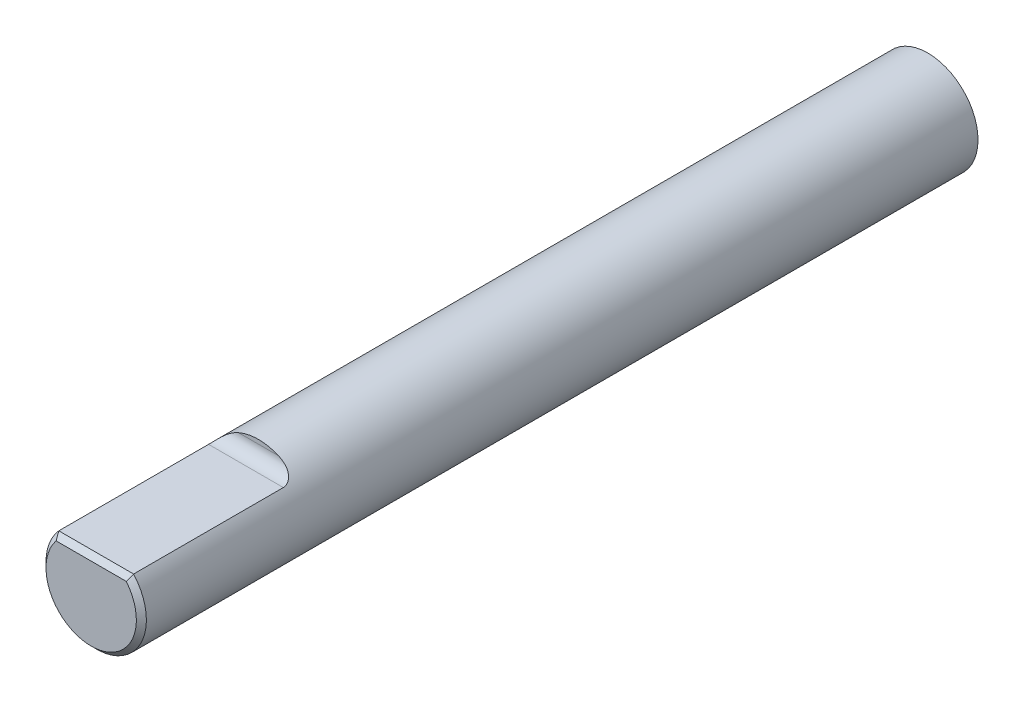
from build123d import *

# Parameters (mm, degrees)
BOSS_EXTRUDE1_DEPTH = 50
SKETCH2_W           = 4.47
SKETCH2_H           = 5
CUT_EXTRUDE2_DEPTH  = 10
CHAMFER1_SIZE       = 0.3
FILLET1_R           = 0.75


with BuildPart() as part:
    # Sketch1 → Boss-Extrude1 (new body)
    with BuildSketch(Plane.XY):
        with BuildLine():
            ThreePointArc((2.35, 1.86480562), (0, 3), (-2.35, 1.86480562))
            Line((-2.35, 1.86480562), (2.35, 1.86480562))
        make_face()
        with BuildLine():
            Line((2.35, 1.86480562), (-2.35, 1.86480562))
            ThreePointArc((-2.35, 1.86480562), (-0.987420883, -2.832843095), (3, 0))
            ThreePointArc((3, 0), (2.832843095, 0.987420883), (2.35, 1.86480562))
        make_face()
    extrude(amount=BOSS_EXTRUDE1_DEPTH)

    # Sketch2 → Cut-Extrude2 (cut)
    with BuildSketch(Plane.XY.offset(50)):
        with Locations((0, 4.501193394)):
            Rectangle(SKETCH2_W, SKETCH2_H)
    extrude(amount=-CUT_EXTRUDE2_DEPTH, mode=Mode.SUBTRACT)

    # Chamfer1
    chamfer1_edges = [part.edges().sort_by_distance(p)[0] for p in [
        (-0.089200091, -2.998673597, 50),
        (0, 2.001193394, 50),
    ]]
    chamfer(chamfer1_edges, length=CHAMFER1_SIZE)

    # Fillet1
    fillet1_edges = [part.edges().sort_by_distance(p)[0] for p in [
        (0, 2.001193394, 40),
    ]]
    fillet(fillet1_edges, radius=FILLET1_R)


solid = part.part
